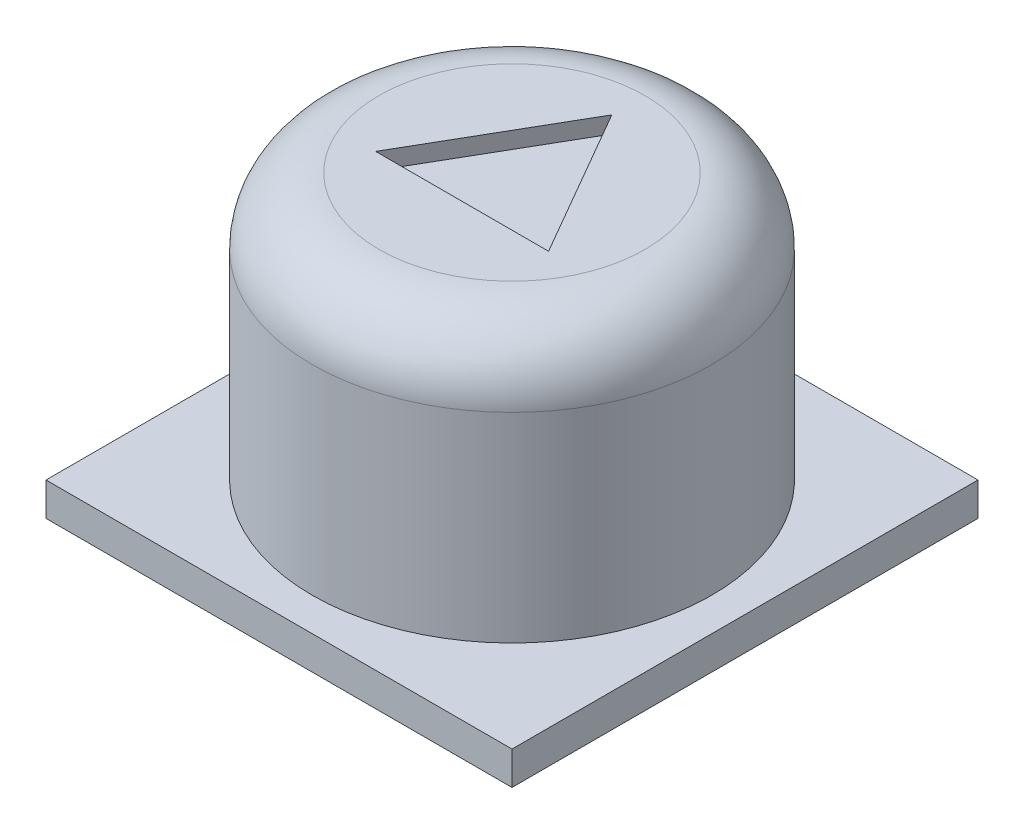
from build123d import *

# Parameters (mm, degrees)
CROQUIS1_W              = 14
CROQUIS1_H              = 14
SALIENTE_EXTRUIR1_DEPTH = 1
CROQUIS2_W              = 4
CROQUIS2_H              = 4
CORTAR_EXTRUIR1_DEPTH   = 1
CROQUIS3_W              = 6
CROQUIS3_H              = 6
SALIENTE_EXTRUIR3_DEPTH = 1
CROQUIS5_W              = 4
CROQUIS5_H              = 4
CORTAR_EXTRUIR3_DEPTH   = 1
CROQUIS6_R              = 6
SALIENTE_EXTRUIR4_DEPTH = 8
CROQUIS7_W              = 6
CROQUIS7_H              = 6
CORTAR_EXTRUIR4_DEPTH   = 2
CROQUIS8_W              = 14
CROQUIS8_H              = 14
SALIENTE_EXTRUIR5_DEPTH = 1
CROQUIS9_W              = 6
CROQUIS9_H              = 6
SALIENTE_EXTRUIR6_DEPTH = 2
CROQUIS10_W             = 4
CROQUIS10_H             = 4
CORTAR_EXTRUIR5_DEPTH   = 2
REDONDEO2_R             = 2
CORTAR_EXTRUIR6_DEPTH   = 0.5


with BuildPart() as part:
    # Croquis1 → Saliente-Extruir1 (new body)
    with BuildSketch(Plane(origin=(0, 0, 0), x_dir=(1, 0, 0), z_dir=(0, 1, 0))):
        Rectangle(CROQUIS1_W, CROQUIS1_H)
    extrude(amount=SALIENTE_EXTRUIR1_DEPTH)

    # Croquis2 → Cortar-Extruir1 (cut)
    with BuildSketch(Plane.XZ):
        Rectangle(CROQUIS2_W, CROQUIS2_H)
    extrude(amount=-CORTAR_EXTRUIR1_DEPTH, mode=Mode.SUBTRACT)

    # Croquis3 → Saliente-Extruir3 (add)
    with BuildSketch(Plane.XZ):
        Rectangle(CROQUIS3_W, CROQUIS3_H)
    extrude(amount=SALIENTE_EXTRUIR3_DEPTH)

    # Croquis5 → Cortar-Extruir3 (cut)
    with BuildSketch(Plane.XZ.offset(1)):
        Rectangle(CROQUIS5_W, CROQUIS5_H)
    extrude(amount=-CORTAR_EXTRUIR3_DEPTH, mode=Mode.SUBTRACT)

    # Croquis6 → Saliente-Extruir4 (add)
    with BuildSketch(Plane(origin=(0, 1, 0), x_dir=(1, 0, 0), z_dir=(0, 1, 0))):
        with Locations(Location((0, 0, 0), (0, 0, 270))):
            Circle(CROQUIS6_R)
    extrude(amount=SALIENTE_EXTRUIR4_DEPTH)

    # Croquis7 → Cortar-Extruir4 (cut)
    with BuildSketch(Plane.XZ.offset(1)):
        Rectangle(CROQUIS7_W, CROQUIS7_H)
    extrude(amount=-CORTAR_EXTRUIR4_DEPTH, mode=Mode.SUBTRACT)

    # Croquis8 → Saliente-Extruir5 (add)
    with BuildSketch(Plane.XZ):
        Rectangle(CROQUIS8_W, CROQUIS8_H)
    extrude(amount=-SALIENTE_EXTRUIR5_DEPTH)

    # Croquis9 → Saliente-Extruir6 (add)
    with BuildSketch(Plane.XZ):
        Rectangle(CROQUIS9_W, CROQUIS9_H)
    extrude(amount=SALIENTE_EXTRUIR6_DEPTH)

    # Croquis10 → Cortar-Extruir5 (cut)
    with BuildSketch(Plane.XZ.offset(2)):
        Rectangle(CROQUIS10_W, CROQUIS10_H)
    extrude(amount=-CORTAR_EXTRUIR5_DEPTH, mode=Mode.SUBTRACT)

    # Redondeo2
    redondeo2_edges = [part.edges().sort_by_distance(p)[0] for p in [
        (0, 9, -6),
    ]]
    fillet(redondeo2_edges, radius=REDONDEO2_R)

    # Croquis11 → Cortar-Extruir6 (cut)
    with BuildSketch(Plane(origin=(0, 9, 0), x_dir=(1, 0, 0), z_dir=(0, 1, 0))):
        Polygon((0, 3), (-2.598076211, -1.5), (2.598076211, -1.5), align=None)
    extrude(amount=-CORTAR_EXTRUIR6_DEPTH, mode=Mode.SUBTRACT)


solid = part.part
